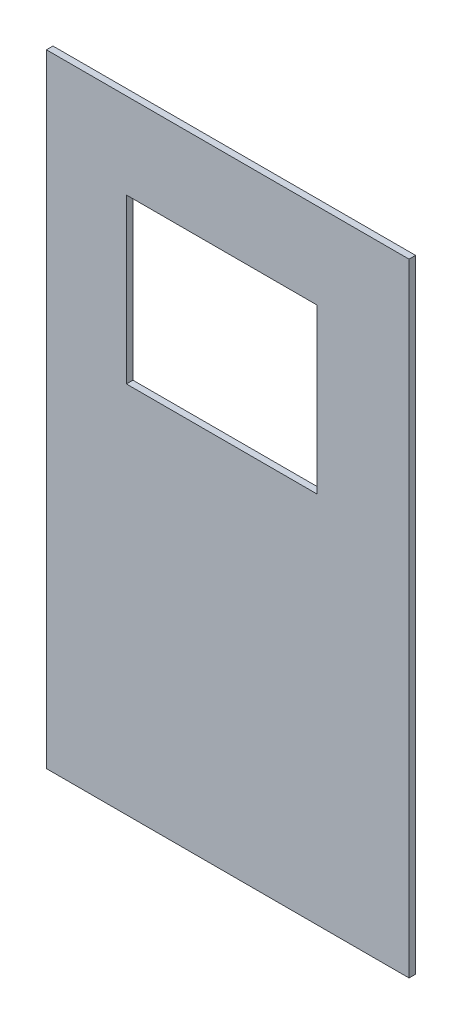
from build123d import *

# Parameters (mm, degrees)
ESQUISSE1_W                  = 233
ESQUISSE1_H                  = 400
BOSS_EXTRU_1_DEPTH           = 4.2
ENL_V_MAT_EXTRU_1_DEPTH      = 279.375274783
ENL_V_MAT_EXTRU_1_DEPTH_BACK = 279.375274783
ESQUISSE2_W                  = 122.323690039
ESQUISSE2_H                  = 105.15953143


with BuildPart() as part:
    # Esquisse1 → Boss.-Extru.1 (new body)
    with BuildSketch(Plane.XY):
        with Locations((-45.332061069, -26.463104326)):
            Rectangle(ESQUISSE1_W, ESQUISSE1_H)
    extrude(amount=BOSS_EXTRU_1_DEPTH)

    # Esquisse2 → Enlèv. mat.-Extru.1 (cut, two sides: drawn at the far end of the back side and taken through both)
    with BuildSketch(Plane.XY.offset(4.2).offset(-ENL_V_MAT_EXTRU_1_DEPTH_BACK)):
        with Locations((-49.296189184, 65.859991666)):
            Rectangle(ESQUISSE2_W, ESQUISSE2_H)
    extrude(amount=ENL_V_MAT_EXTRU_1_DEPTH + ENL_V_MAT_EXTRU_1_DEPTH_BACK, mode=Mode.SUBTRACT)


solid = part.part
